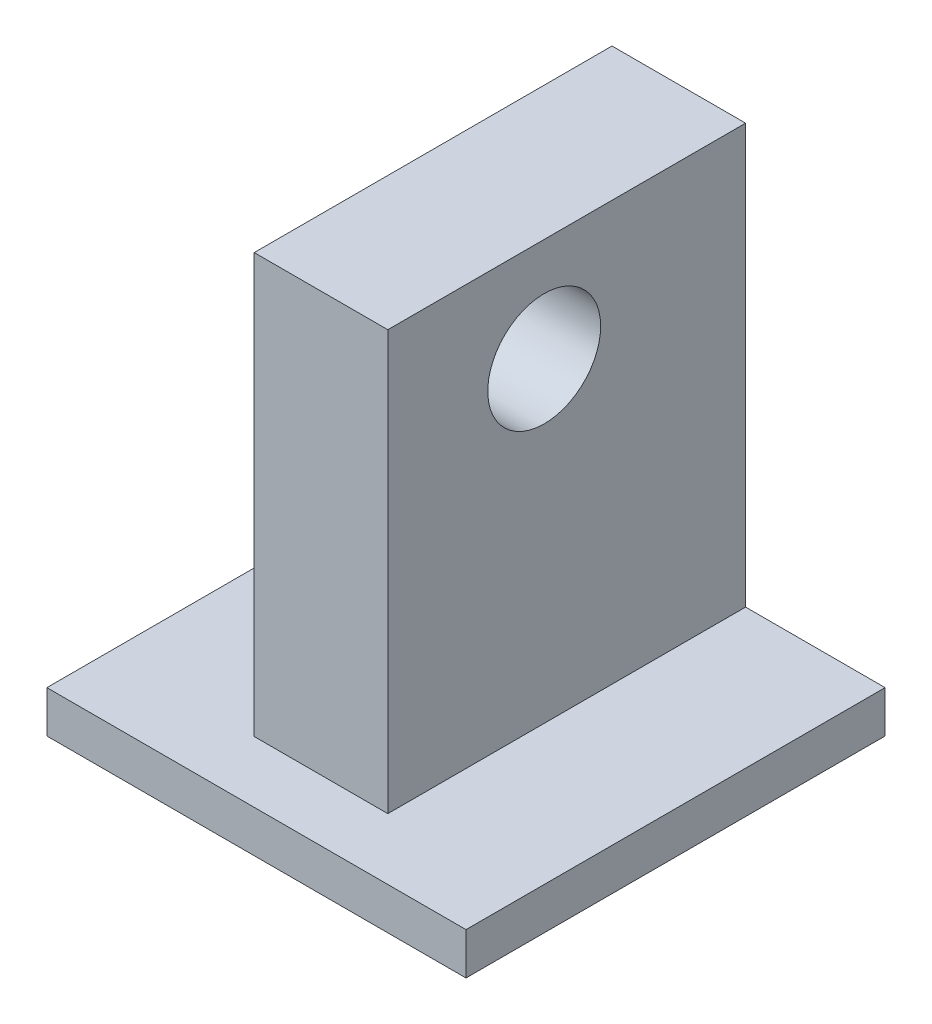
from build123d import *

# Parameters (mm, degrees)
CROQUIS1_W              = 30
CROQUIS1_H              = 30
SALIENTE_EXTRUIR1_DEPTH = 3
CROQUIS2_W              = 9.563107214
CROQUIS2_H              = 25.610650669
SALIENTE_EXTRUIR2_DEPTH = 30
CROQUIS3_R              = 4.0394072
CORTAR_EXTRUIR1_DEPTH   = 10


with BuildPart() as part:
    # Croquis1 → Saliente-Extruir1 (new body)
    with BuildSketch(Plane(origin=(0, 0, 0), x_dir=(1, 0, 0), z_dir=(0, 1, 0))):
        Rectangle(CROQUIS1_W, CROQUIS1_H)
    extrude(amount=SALIENTE_EXTRUIR1_DEPTH)

    # Croquis2 → Saliente-Extruir2 (add)
    with BuildSketch(Plane(origin=(0, 3, 0), x_dir=(1, 0, 0), z_dir=(0, 1, 0))):
        with Locations((0.232305854, 2.194674666)):
            Rectangle(CROQUIS2_W, CROQUIS2_H)
    extrude(amount=SALIENTE_EXTRUIR2_DEPTH)

    # Croquis3 → Cortar-Extruir1 (cut)
    with BuildSketch(Plane(origin=(5.013859461, 0, 0), x_dir=(0, 0, -1), z_dir=(1, 0, 0))):
        with Locations((0.584677198, 25.603738422)):
            Circle(CROQUIS3_R)
    extrude(amount=-CORTAR_EXTRUIR1_DEPTH, mode=Mode.SUBTRACT)


solid = part.part
